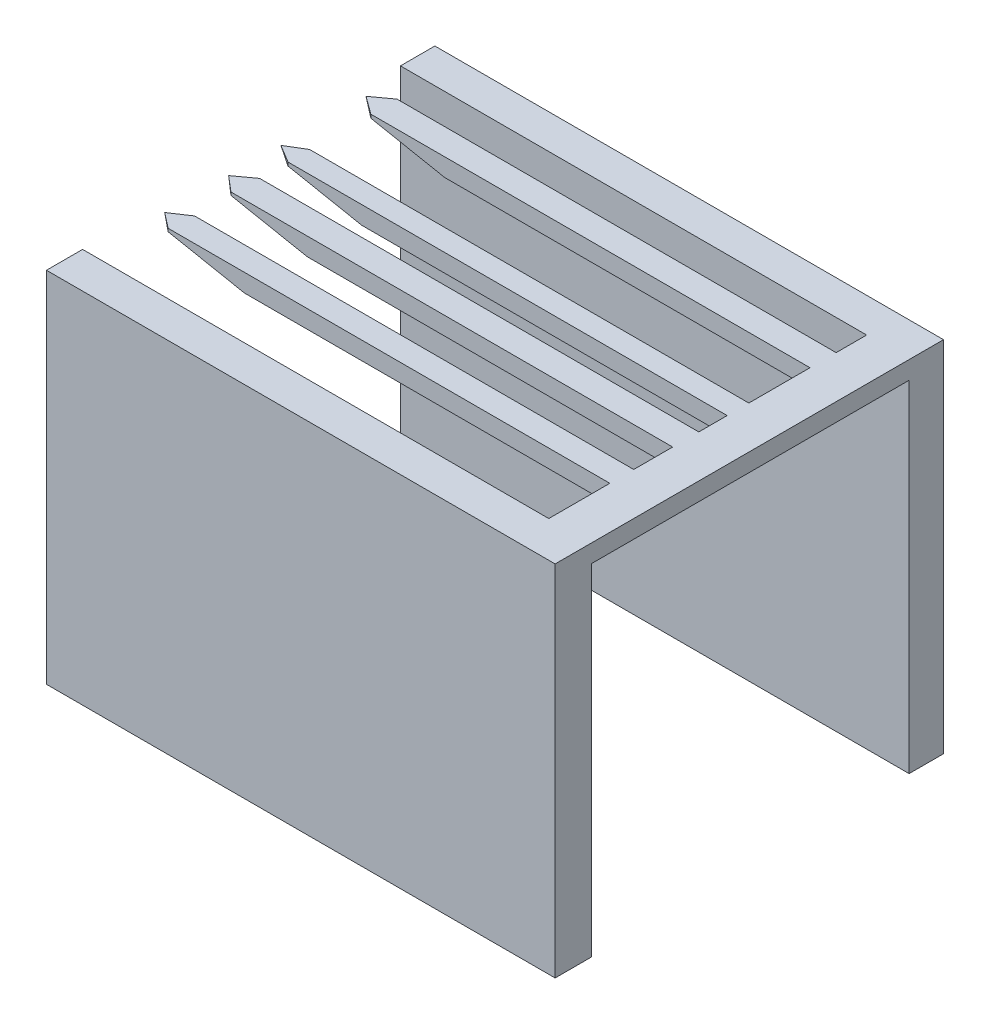
from build123d import *

# Parameters (mm, degrees)
SKETCH1_W               = 141.842971217
SKETCH1_H               = 108.306454767
BOSS_EXTRUDE1_DEPTH     = 5
BOSS_EXTRUDE2_DEPTH     = 95
SKETCH3_W               = 111.927402264
SKETCH3_H               = 61.729715964
CUT_EXTRUDE1_DEPTH      = 95
SKETCH4_W               = 61.729715964
SKETCH4_H               = 100
CUT_EXTRUDE2_DEPTH      = 95
SKETCH5_W               = 141.842971217
SKETCH5_H               = 26.901252983
CUT_EXTRUDE3_DEPTH      = 135
BOSS_EXTRUDE3_DEPTH     = 5
CUT_EXTRUDE4_DEPTH      = 65
CUT_EXTRUDE4_DEPTH_BACK = 15


with BuildPart() as part:
    # Sketch1 → Boss-Extrude1 (new body)
    with BuildSketch(Plane(origin=(0, 0, 22.06567104), x_dir=(1, 0, 0), z_dir=(0, 1, 0))):
        with Locations((16.768258226, -27.626392649)):
            Rectangle(SKETCH1_W, SKETCH1_H)
    extrude(amount=BOSS_EXTRUDE1_DEPTH)

    # Sketch2 → Boss-Extrude2 (add)
    with BuildSketch(Plane(origin=(0, 5, 22.06567104), x_dir=(1, 0, 0), z_dir=(0, 1, 0))):
        Polygon((-54.153227383, -81.779620033), (87.689743834, -81.779620033), (87.689743834, -44.802673151), (87.689743834, 26.526834734), (57.774174881, 26.526834734), (-54.153227383, 26.526834734), (-54.153227383, 16.927042813), (57.774174881, 16.927042813), (57.774174881, -44.802673151), (-54.153227383, -44.802673151), align=None)
    extrude(amount=BOSS_EXTRUDE2_DEPTH)

    # Sketch3 → Cut-Extrude1 (cut)
    with BuildSketch(Plane(origin=(0, 5, 22.06567104), x_dir=(1, 0, 0), z_dir=(0, 1, 0))):
        with Locations((1.810473749, -13.937815169)):
            Rectangle(SKETCH3_W, SKETCH3_H)
    extrude(amount=-CUT_EXTRUDE1_DEPTH, mode=Mode.SUBTRACT)

    # Sketch4 → Cut-Extrude2 (cut)
    with BuildSketch(Plane(origin=(57.774174881, 0, 22.06567104), x_dir=(0, 0, 1), z_dir=(-1, 0, 0))):
        with Locations((13.937815169, 50)):
            Rectangle(SKETCH4_W, SKETCH4_H)
    extrude(amount=-CUT_EXTRUDE2_DEPTH, mode=Mode.SUBTRACT)


with BuildPart() as cut_extrude2_piece_1:
    # of the separate pieces the step leaves, piece 1, a body of its own (cut_extrude2_pieces)
    add(part.part.solids().sort_by_distance((-54.153227383, 100, 66.868344191))[0])

    # Sketch5 → Cut-Extrude3 (cut)
    with BuildSketch(Plane(origin=(0, 100, 0), x_dir=(1, 0, 0), z_dir=(0, 1, 0))):
        with Locations((16.768258226, -80.318970683)):
            Rectangle(SKETCH5_W, SKETCH5_H)
    extrude(amount=-CUT_EXTRUDE3_DEPTH, mode=Mode.SUBTRACT)



with BuildPart() as cut_extrude2_piece_2:
    # of the separate pieces the step leaves, piece 2, a body of its own (cut_extrude2_pieces)
    add(part.part.solids().sort_by_distance((-54.153227383, 0, -4.461163693))[0])


with BuildPart() as cut_extrude2_piece_1_1:
    add(cut_extrude2_piece_1.part)

    add(cut_extrude2_piece_2.part)  # Boss-Extrude3 merges Cut-Extrude2 piece 2
    # Sketch6 → Boss-Extrude3 (add)
    with BuildSketch(Plane(origin=(0, 100, 0), x_dir=(1, 0, 0), z_dir=(0, 1, 0))):
        Polygon((87.689743834, -103.845291074), (87.689743834, 4.461163693), (75.84574379, 4.461163693), (75.84574379, -13.640842184), (-46.610502058, -13.640842184), (-51.612768373, -17.284729089), (-46.610502058, -20.928615994), (75.84574379, -20.928615994), (75.84574379, -37.985107889), (-46.610502058, -37.985107889), (-51.612768373, -41.008758725), (-46.610502058, -44.032409561), (75.84574379, -44.032409561), (75.84574379, -51.94041944), (-46.610502058, -51.94041944), (-51.612768373, -55.584306345), (-47.3197879, -59.22819325), (75.84574379, -59.22819325), (75.84574379, -70.082324456), (-46.610502058, -70.082324456), (-51.612768373, -73.416093326), (-47.3197879, -76.749862197), (75.84574379, -76.749862197), (75.84574379, -103.845291074), align=None)
    extrude(amount=-BOSS_EXTRUDE3_DEPTH)

    # Sketch7 → Cut-Extrude4 (cut, two sides: drawn at the far end of the back side and taken through both)
    with BuildSketch(Plane.XY.offset(20.928615994).offset(-CUT_EXTRUDE4_DEPTH_BACK)):
        Polygon((-51.612768373, 100), (-26.03457971, 95), (-51.612768373, 95), align=None)
    extrude(amount=CUT_EXTRUDE4_DEPTH + CUT_EXTRUDE4_DEPTH_BACK, mode=Mode.SUBTRACT)


solid = cut_extrude2_piece_1_1.part
